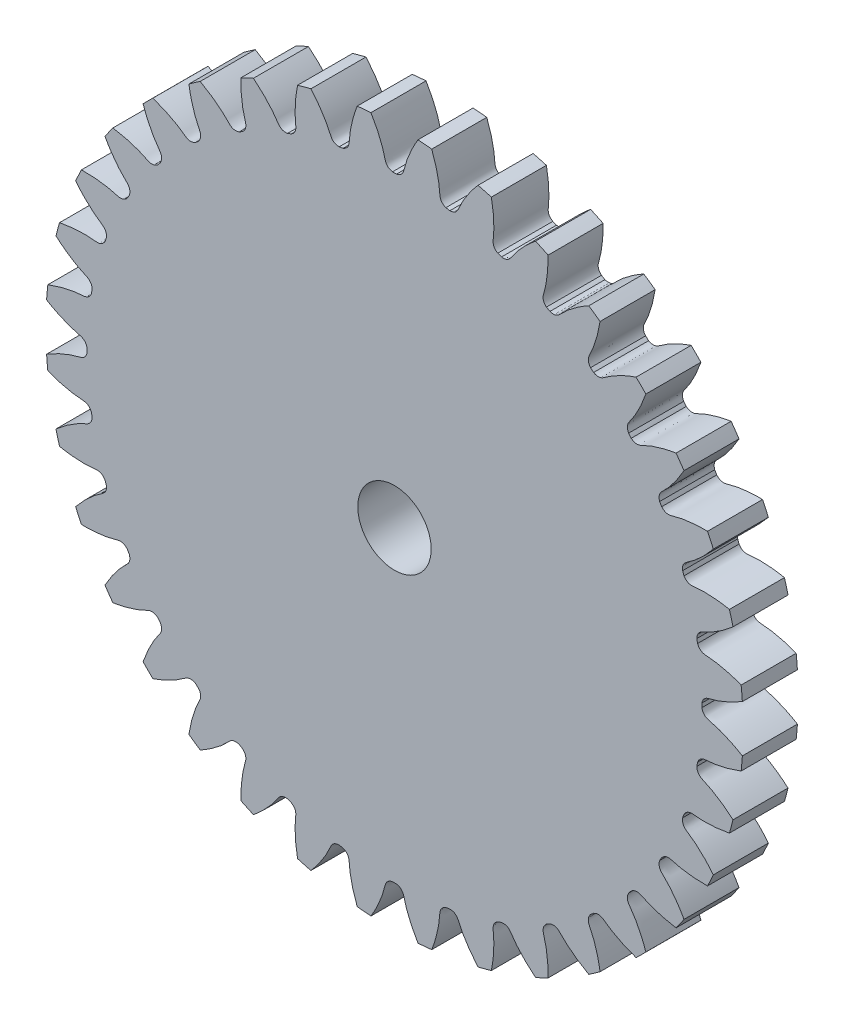
from build123d import *

# Parameters (mm, degrees)
SKETCH_1_R               = 9.5
EXTRUDE_1_DEPTH          = 1.5
CUT_EXTRUDE_1_DEPTH      = 14.518505835
PATTERN_CIRCULAR_1_COUNT = 36
SKETCH_4_R               = 1
CUT_EXTRUDE_2_DEPTH      = 14.488126486


with BuildPart() as part:
    # 草图1 → 凸台-拉伸1 (new body)
    with BuildSketch(Plane.XY):
        Circle(SKETCH_1_R)
    extrude(amount=-EXTRUDE_1_DEPTH)

    # 草图2 → 切除-拉伸1 (cut, through all)
    with BuildSketch(Plane.XY):
        with BuildLine():
            ThreePointArc((0.054934474, 8.374819831), (0, 8.375), (-0.054934474, 8.374819831))
            add(Edge.make_bspline(
                [(-0.054934474, 8.374819831), (-0.234978953, 8.415201319), (-0.250497423, 8.549314662), (-0.288218357, 8.691373568), (-0.299748628, 8.731851177), (-0.31309989, 8.775314366), (-0.328367396, 8.821718829), (-0.34568221, 8.870999935), (-0.365162519, 8.923094297), (-0.386928046, 8.977933385), (-0.411095645, 9.035445483), (-0.437780475, 9.09555517), (-0.467095531, 9.15818354), (-0.499151661, 9.223248205), (-0.534057436, 9.290663368), (-0.571919068, 9.360339873), (-0.612840323, 9.432185269), (-0.656922424, 9.506103874), (-0.704263969, 9.581996838), (-0.754960844, 9.659762209), (-0.809106137, 9.739295006), (-0.866790057, 9.820487287), (-0.928099853, 9.903228226), (-0.993119734, 9.987404187), (-1.061930793, 10.072898798), (-1.134610932, 10.15959304), (-1.211234787, 10.247365317), (-1.291873657, 10.33609155), (-1.376595441, 10.425645255), (-1.46546454, 10.515897632), (-1.591181957, 10.63856609), (-1.689482035, 10.72881939), (-1.757006718, 10.78843362)],
                knots=[0, 0, 0, 0, 0.120371484, 0.133302531, 0.147363917, 0.16255564, 0.178877702, 0.196330101, 0.214912839, 0.234625915, 0.25546933, 0.277443082, 0.300547173, 0.324781601, 0.350146368, 0.376641473, 0.404266917, 0.433022698, 0.462908818, 0.493925275, 0.526072071, 0.559349205, 0.593756678, 0.629294488, 0.665962637, 0.703761124, 0.742689949, 0.782749112, 0.823938613, 0.866258453, 0.90970863, 1, 1, 1, 1], degree=3))
            ThreePointArc((-1.757006718, 10.78843362), (0, 10.930570551), (1.757006718, 10.78843362))
            add(Edge.make_bspline(
                [(0.054934474, 8.374819831), (0.234978953, 8.415201319), (0.250497423, 8.549314662), (0.288218357, 8.691373568), (0.299748628, 8.731851177), (0.31309989, 8.775314366), (0.328367396, 8.821718829), (0.34568221, 8.870999935), (0.365162519, 8.923094297), (0.386928046, 8.977933385), (0.411095645, 9.035445483), (0.437780475, 9.09555517), (0.467095531, 9.15818354), (0.499151661, 9.223248205), (0.534057436, 9.290663368), (0.571919068, 9.360339873), (0.612840323, 9.432185269), (0.656922424, 9.506103874), (0.704263969, 9.581996838), (0.754960844, 9.659762209), (0.809106137, 9.739295006), (0.866790057, 9.820487287), (0.928099853, 9.903228226), (0.993119734, 9.987404187), (1.061930793, 10.072898798), (1.134610932, 10.15959304), (1.211234787, 10.247365317), (1.291873657, 10.33609155), (1.376595441, 10.425645255), (1.46546454, 10.515897632), (1.591181957, 10.63856609), (1.689482035, 10.72881939), (1.757006718, 10.78843362)],
                knots=[0, 0, 0, 0, 0.120371484, 0.133302531, 0.147363917, 0.16255564, 0.178877702, 0.196330101, 0.214912839, 0.234625915, 0.25546933, 0.277443082, 0.300547173, 0.324781601, 0.350146368, 0.376641473, 0.404266917, 0.433022698, 0.462908818, 0.493925275, 0.526072071, 0.559349205, 0.593756678, 0.629294488, 0.665962637, 0.703761124, 0.742689949, 0.782749112, 0.823938613, 0.866258453, 0.90970863, 1, 1, 1, 1], degree=3))
        make_face()
    cut_extrude_1 = extrude(amount=-CUT_EXTRUDE_1_DEPTH, mode=Mode.SUBTRACT)

    # 阵列(圆周)1: 切除-拉伸1 ×36 about axis
    pattern_circular_1_axis = Axis((0, 0, 0), (0, 0, -1))
    for i in range(1, PATTERN_CIRCULAR_1_COUNT):
        add(cut_extrude_1.rotate(pattern_circular_1_axis, i * 360 / PATTERN_CIRCULAR_1_COUNT), mode=Mode.SUBTRACT)

    # 草图4 → 切除-拉伸2 (cut, through all)
    with BuildSketch(Plane.XY):
        Circle(SKETCH_4_R)
    extrude(amount=-CUT_EXTRUDE_2_DEPTH, mode=Mode.SUBTRACT)


solid = part.part
